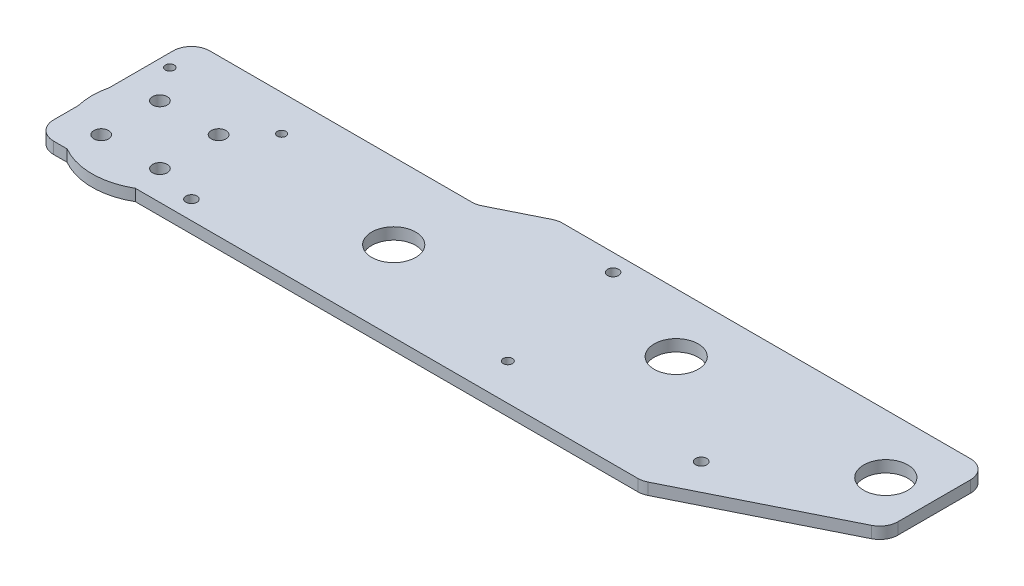
from build123d import *

# Parameters (mm, degrees)
SKETCH1_W           = 210
SKETCH1_H           = 50
SKETCH1_R           = 1.211665018
SKETCH1_R_2         = 1.165617118
SKETCH1_R_3         = 1.5
SKETCH1_R_4         = 1.25
SKETCH1_R_5         = 1.517273905
BOSS_EXTRUDE1_DEPTH = 3.175
SKETCH2_R           = 2
CUT_EXTRUDE1_DEPTH  = 10
SKETCH3_R           = 6
SKETCH3_R_2         = 0.586995366
CUT_EXTRUDE2_DEPTH  = 57.15
CUT_EXTRUDE7_DEPTH  = 10
FILLET3_R           = 5
SKETCH11_R          = 18.5
SKETCH11_R_2        = 2
BOSS_EXTRUDE4_DEPTH = 3.175


with BuildPart() as part:
    # Sketch1 → Boss-Extrude1 (new body)
    with BuildSketch(Plane(origin=(0, 0, 0), x_dir=(1, 0, 0), z_dir=(0, 1, 0))):
        with Locations((105, -25)):
            Rectangle(SKETCH1_W, SKETCH1_H)
        with Locations(Location((3.489526233, -16.787661112, 0), (0, 0, 270))):
            Circle(SKETCH1_R, mode=Mode.SUBTRACT)
        with Locations(Location((34.37258772, -17.194005245, 0), (0, 0, 270))):
            Circle(SKETCH1_R_2, mode=Mode.SUBTRACT)
        with Locations(Location((37.520749958, -44.921198121, 0), (0, 0, 270))):
            Circle(SKETCH1_R_3, mode=Mode.SUBTRACT)
        with Locations(Location((118.879039361, -40.017685043, 0), (0, 0, 270))):
            Circle(SKETCH1_R_4, mode=Mode.SUBTRACT)
        with Locations(Location((112.302052499, -4.739260115, 0), (0, 0, 270))):
            Circle(SKETCH1_R_3, mode=Mode.SUBTRACT)
        with Locations(Location((168.975233936, -37.403209633, 0), (0, 0, 270))):
            Circle(SKETCH1_R_5, mode=Mode.SUBTRACT)
    extrude(amount=BOSS_EXTRUDE1_DEPTH)

    # Sketch2 → Cut-Extrude1 (cut)
    with BuildSketch(Plane(origin=(0, 3.175, 0), x_dir=(1, 0, 0), z_dir=(0, 1, 0))):
        with Locations(Location((10, -26, 0), (0, 0, 270))):
            Circle(SKETCH2_R)
        with Locations(Location((10, -42, 0), (0, 0, 270))):
            Circle(SKETCH2_R)
        with Locations(Location((26, -26, 0), (0, 0, 270))):
            Circle(SKETCH2_R)
        with Locations(Location((26, -42, 0), (0, 0, 270))):
            Circle(SKETCH2_R)
    extrude(amount=-CUT_EXTRUDE1_DEPTH, mode=Mode.SUBTRACT)

    # Sketch3 → Cut-Extrude2 (cut)
    with BuildSketch(Plane(origin=(0, 3.175, 0), x_dir=(1, 0, 0), z_dir=(0, 1, 0))):
        with Locations(Location((75.84991357, -28.1, 0), (0, 0, 270))):
            Circle(SKETCH3_R)
        with Locations(Location((140.771956051, -16, 0), (0, 0, 270))):
            Circle(SKETCH3_R)
        with Locations(Location((18, -34, 0), (0, 0, 270))):
            Circle(SKETCH3_R_2)
        with Locations(Location((197.921956051, -16, 0), (0, 0, 270))):
            Circle(SKETCH3_R)
    extrude(amount=-CUT_EXTRUDE2_DEPTH, mode=Mode.SUBTRACT)

    # Sketch10 → Cut-Extrude7 (cut)
    with BuildSketch(Plane(origin=(0, 3.175, 0), x_dir=(1, 0, 0), z_dir=(0, 1, 0))):
        Polygon((210, -27.859435908), (165.502877994, -50), (210, -50), align=None)
        Polygon((92.532613397, 0), (77.65477062, -7.402812063), (0, -7.402812063), (0, 0), align=None)
    extrude(amount=-CUT_EXTRUDE7_DEPTH, mode=Mode.SUBTRACT)

    # Fillet3
    fillet3_edges = [part.edges().sort_by_distance(p)[0] for p in [
        (210, 1.5875, 0),
        (0, 1.5875, 50),
        (92.532613397, 1.5875, 0),
        (210, 1.5875, 27.859435908),
        (165.502877994, 1.5875, 50),
        (77.65477062, 1.5875, 7.402812063),
        (0, 1.5875, 7.402812063),
    ]]
    fillet(fillet3_edges, radius=FILLET3_R)

    # Sketch11 → Boss-Extrude4 (add)
    with BuildSketch(Plane(origin=(0, 3.175, 0), x_dir=(1, 0, 0), z_dir=(0, 1, 0))):
        with Locations((18, -34)):
            Circle(SKETCH11_R)
        with Locations(Location((10, -26, 0), (0, 0, 270))):
            Circle(SKETCH11_R_2, mode=Mode.SUBTRACT)
        with Locations(Location((10, -42, 0), (0, 0, 270))):
            Circle(SKETCH11_R_2, mode=Mode.SUBTRACT)
        with Locations(Location((26, -26, 0), (0, 0, 270))):
            Circle(SKETCH11_R_2, mode=Mode.SUBTRACT)
        with Locations(Location((26, -42, 0), (0, 0, 270))):
            Circle(SKETCH11_R_2, mode=Mode.SUBTRACT)
    extrude(amount=-BOSS_EXTRUDE4_DEPTH)


solid = part.part
